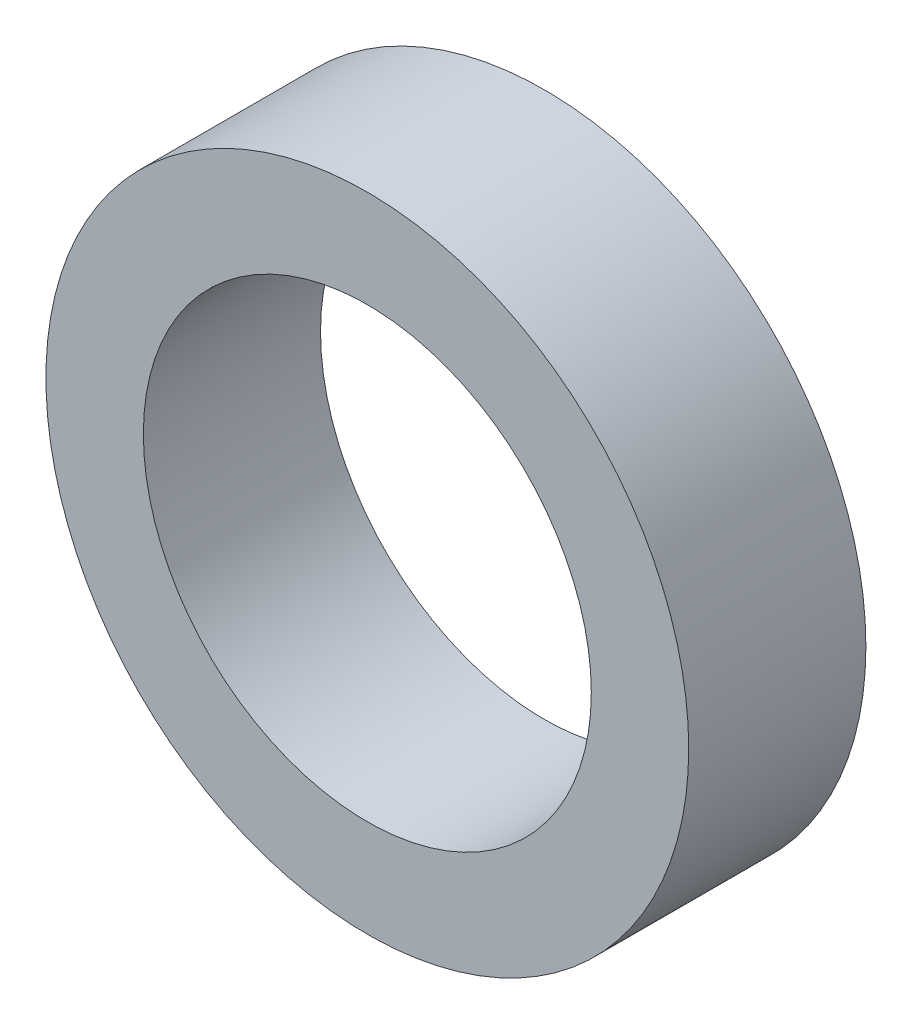
from build123d import *

# Parameters (mm, degrees)
TIRE_REFERENCE_START = -35
SKETCH_1_R           = 127
SKETCH_1_R_2         = 88.5
TIRE_REFERENCE_DEPTH = 70


with BuildPart() as part:
    # Эскиз1 → Tire_reference (new body)
    with BuildSketch(Plane.XY.offset(TIRE_REFERENCE_START)):
        Circle(SKETCH_1_R)
        Circle(SKETCH_1_R_2, mode=Mode.SUBTRACT)
    extrude(amount=TIRE_REFERENCE_DEPTH)


solid = part.part
